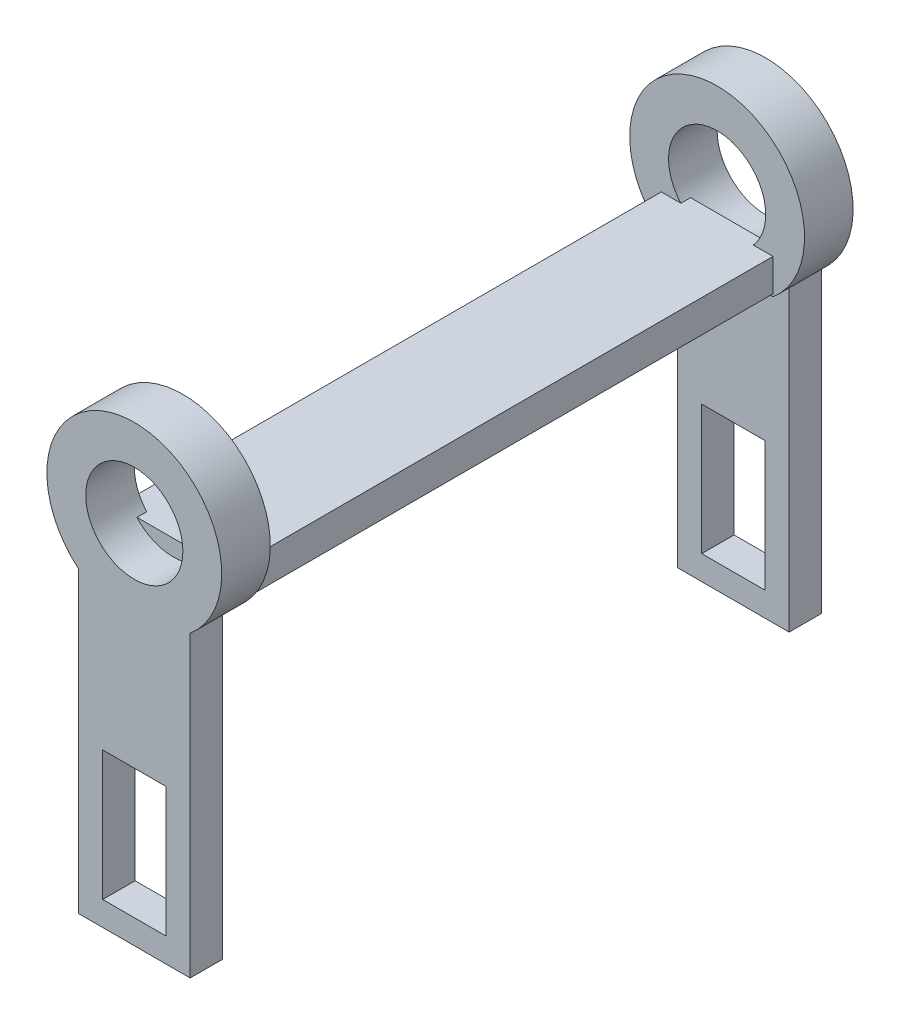
from build123d import *
from build123d.topology import SkipClean

# Parameters (mm, degrees)
ESQUISSE1_W             = 34.5
ESQUISSE1_H             = 55
ESQUISSE1_W_2           = 19.5
ESQUISSE1_H_2           = 40
BOSS_EXTRU_1_DEPTH      = 10
ESQUISSE6_W             = 34.5
ESQUISSE6_H             = 10
BOSS_EXTRU_2_DEPTH      = 48
ESQUISSE7_W             = 34.5
ESQUISSE7_H             = 10
BOSS_EXTRU_3_DEPTH      = 87.5
BOSS_EXTRU_4_DEPTH      = 15
ESQUISSE9_R             = 15
ENL_V_MAT_EXTRU_1_DEPTH = 12
BOSS_EXTRU_5_REACH      = 231.433
BOSS_EXTRU_5_END_RADIUS = 27
ESQUISSE10_W            = 5
ESQUISSE10_H            = 0.771073636


with BuildPart() as part:
    # Esquisse1 → Boss.-Extru.1 (new body)
    with BuildSketch(Plane.XY):
        Rectangle(ESQUISSE1_W, ESQUISSE1_H)
        Rectangle(ESQUISSE1_W_2, ESQUISSE1_H_2, mode=Mode.SUBTRACT)
    boss_extru_1 = extrude(amount=BOSS_EXTRU_1_DEPTH)

    # Esquisse6 → Boss.-Extru.2 (add)
    with BuildSketch(Plane(origin=(0, 27.5, 0), x_dir=(1, 0, 0), z_dir=(0, 1, 0))):
        with Locations((0, -5)):
            Rectangle(ESQUISSE6_W, ESQUISSE6_H)
    boss_extru_2 = extrude(amount=BOSS_EXTRU_2_DEPTH)

    # Esquisse7 → Boss.-Extru.3 (add)
    with BuildSketch(Plane.XY.offset(10)):
        with Locations((0, 70.5)):
            Rectangle(ESQUISSE7_W, ESQUISSE7_H)
    boss_extru_3 = extrude(amount=BOSS_EXTRU_3_DEPTH)

    # Symétrie1: Boss.-Extru.1, Boss.-Extru.2, Boss.-Extru.3 across plane
    add(boss_extru_1.mirror(Plane(origin=(0, 0, 97.5), x_dir=(1, 0, 0), z_dir=(0, 0, -1))))
    add(boss_extru_2.mirror(Plane(origin=(0, 0, 97.5), x_dir=(1, 0, 0), z_dir=(0, 0, -1))))
    add(boss_extru_3.mirror(Plane(origin=(0, 0, 97.5), x_dir=(1, 0, 0), z_dir=(0, 0, -1))))

    # Esquisse8 → Boss.-Extru.4 (add)
    with BuildSketch(Plane.XY.offset(195)):
        with BuildLine():
            Line((11.180339887, 75.5), (17.25, 75.5))
            Line((17.25, 75.5), (17.25, 64.728926364))
            ThreePointArc((17.25, 64.728926364), (25.395068302, 94.670087563), (0, 112.5))
            Line((0, 112.5), (0, 100.5))
            ThreePointArc((0, 100.5), (10.606601718, 96.106601718), (15, 85.5))
            ThreePointArc((15, 85.5), (14.012585384, 80.147668653), (11.180339887, 75.5))
        make_face()
        with BuildLine():
            Line((0, 100.5), (0, 112.5))
            ThreePointArc((0, 112.5), (-25.395068302, 94.670087563), (-17.25, 64.728926364))
            Line((-17.25, 64.728926364), (-17.25, 75.5))
            Line((-17.25, 75.5), (-11.180339887, 75.5))
            ThreePointArc((-11.180339887, 75.5), (-13.693063938, 91.623724357), (0, 100.5))
        make_face()
    boss_extru_4 = extrude(amount=-BOSS_EXTRU_4_DEPTH)

    # Esquisse9 → Enlèv. mat.-Extru.1 (cut)
    with SkipClean():  # the faces are left unmerged after this step: merging them gives an invalid solid
        with BuildSketch(Plane.XY.offset(195)):
            with Locations((0, 85.5)):
                Circle(ESQUISSE9_R)
        enl_v_mat_extru_1 = extrude(amount=-ENL_V_MAT_EXTRU_1_DEPTH, mode=Mode.SUBTRACT)

    # Boss.-Extru.5: up to this cylinder (the profile starts inside it)
    with SkipClean():  # the faces are left unmerged after this step: merging them gives an invalid solid
        boss_extru_5_end = Plane(origin=(0, 85.5, 182.5), z_dir=(0, 0, 1)) * Cylinder(BOSS_EXTRU_5_END_RADIUS, 517.866, mode=Mode.PRIVATE)
        # Esquisse10 → Boss.-Extru.5 (add, up to the surface)
        with BuildSketch(Plane.ZY.offset(-17.25), mode=Mode.PRIVATE) as boss_extru_5_sk1:
            with Locations((182.5, 65.114463182)):
                Rectangle(ESQUISSE10_W, ESQUISSE10_H)
        boss_extru_5_tool1 = extrude(boss_extru_5_sk1.sketch, amount=BOSS_EXTRU_5_REACH, mode=Mode.PRIVATE) & boss_extru_5_end
        boss_extru_5 = boss_extru_5_tool1.solids().sort_by_distance((17.25, 65.114463, 182.5))[0]
        add(boss_extru_5)

    # Symétrie2: Boss.-Extru.4, Enlèv. mat.-Extru.1, Boss.-Extru.5 across plane
    with SkipClean():  # the faces are left unmerged after this step: merging them gives an invalid solid
        add(boss_extru_4.mirror(Plane(origin=(0, 0, 97.5), x_dir=(1, 0, 0), z_dir=(0, 0, -1))))
        add(enl_v_mat_extru_1.mirror(Plane(origin=(0, 0, 97.5), x_dir=(1, 0, 0), z_dir=(0, 0, -1))), mode=Mode.SUBTRACT)
        add(boss_extru_5.mirror(Plane(origin=(0, 0, 97.5), x_dir=(1, 0, 0), z_dir=(0, 0, -1))))


solid = part.part
